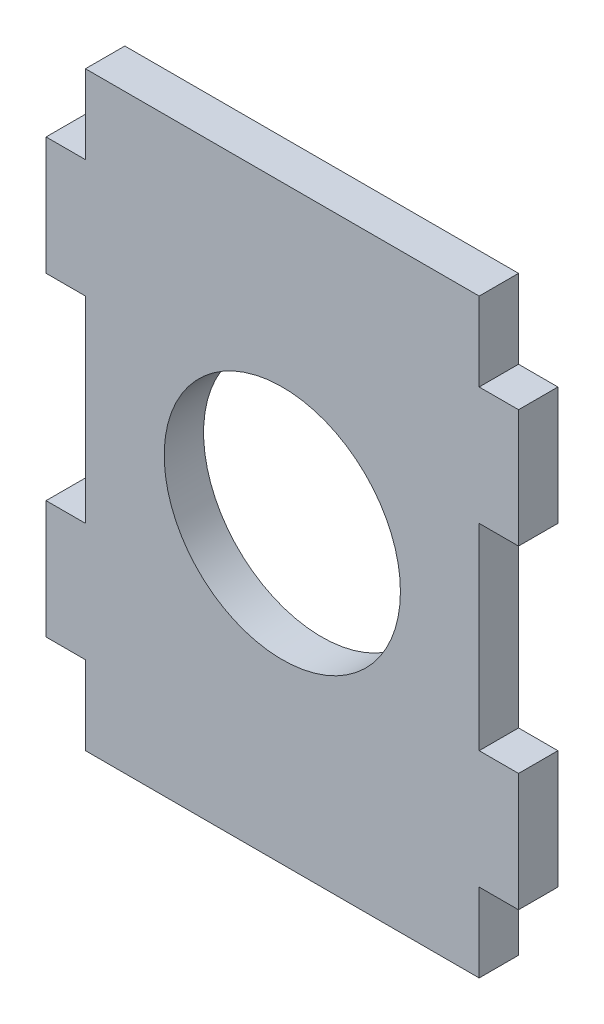
from build123d import *

# Parameters (mm, degrees)
SKETCH1_W           = 3.175
SKETCH1_H           = 9.525
SKETCH1_W_2         = 31.75
SKETCH1_H_2         = 47.625
SKETCH1_R           = 9.525
BOSS_EXTRUDE1_DEPTH = 3.175


with BuildPart() as part:
    # Sketch1 → Boss-Extrude1 (new body)
    # profile 1 of 5: a face of its own
    with BuildSketch(Plane.XY):
        with Locations((-17.4625, 12.7)):
            Rectangle(SKETCH1_W, SKETCH1_H)
    # profile 2 of 5: a face of its own
    with BuildSketch(Plane.XY):
        Rectangle(SKETCH1_W_2, SKETCH1_H_2)
        Circle(SKETCH1_R, mode=Mode.SUBTRACT)
    # profile 3 of 5: a face of its own
    with BuildSketch(Plane.XY):
        with Locations((-17.4625, -12.7)):
            Rectangle(SKETCH1_W, SKETCH1_H)
    # profile 4 of 5: a face of its own
    with BuildSketch(Plane.XY):
        with Locations((17.4625, 12.7)):
            Rectangle(SKETCH1_W, SKETCH1_H)
    # profile 5 of 5: a face of its own
    with BuildSketch(Plane.XY):
        with Locations((17.4625, -12.7)):
            Rectangle(SKETCH1_W, SKETCH1_H)
    extrude(amount=BOSS_EXTRUDE1_DEPTH)


solid = part.part
